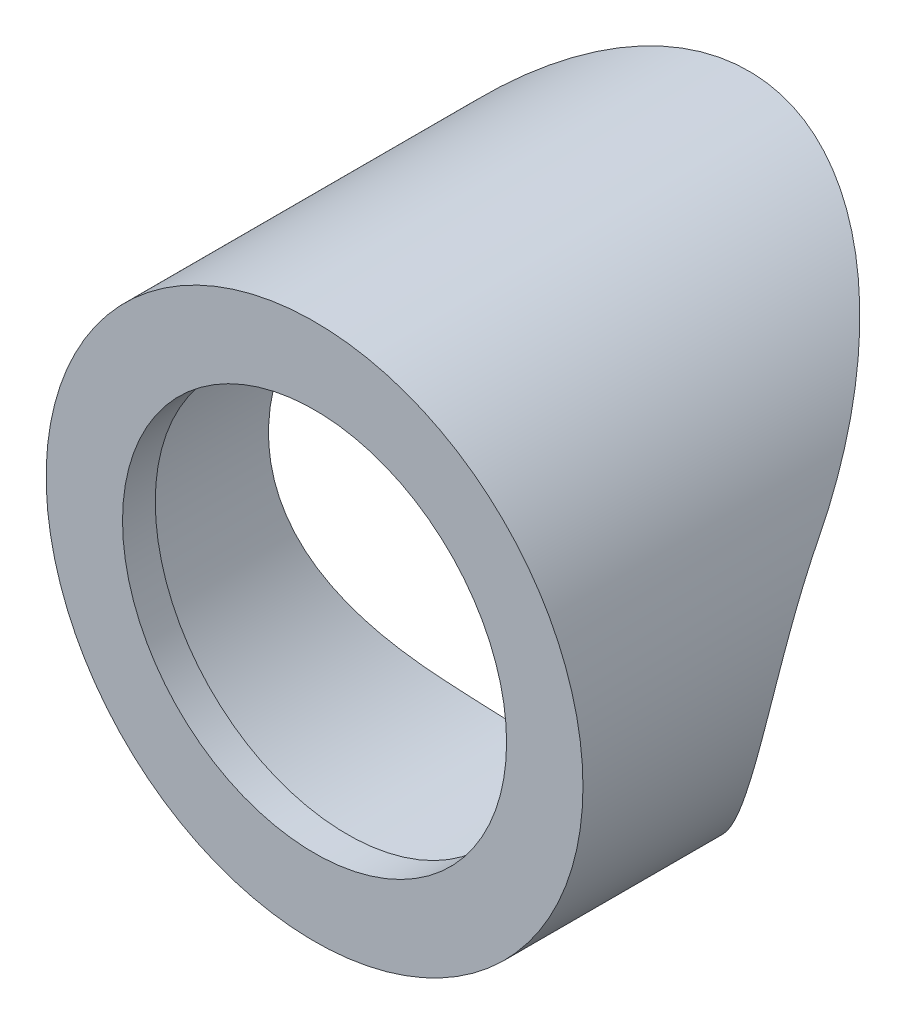
from build123d import *

# Parameters (mm, degrees)
ENL_V_MAT_EXTRU_1_DEPTH      = 27.506225684
ENL_V_MAT_EXTRU_1_DEPTH_BACK = 27.506225684
ESQUISSE4_W                  = 2
ESQUISSE4_H                  = 1.5
BOSS_EXTRU_1_DEPTH           = 5


with BuildPart() as part:
    # Esquisse2 → Révolution1 (revolve)
    with BuildSketch(Plane(origin=(0, 0, 0), x_dir=(0, 0, -1), z_dir=(1, 0, 0)), mode=Mode.PRIVATE) as r_volution1_sk:
        Polygon((0, 8.8), (1.5, 8.8), (1.5, 10.8), (20, 10.8), (20, 12.3), (0, 12.3), align=None)
    revolve(r_volution1_sk.sketch.rotate(Axis((0, 0, 0), (0, 0, -1)), 90), axis=Axis((0, 0, 0), (0, 0, -1)))

    # Esquisse3 → Enlèv. mat.-Extru.1 (cut, two sides: drawn at the far end of the back side and taken through both)
    with BuildSketch(Plane(origin=(0, 0, 0), x_dir=(0, 0, -1), z_dir=(1, 0, 0)).offset(-ENL_V_MAT_EXTRU_1_DEPTH_BACK)):
        with BuildLine():
            Line((12.9, -12.3), (20, -12.3))
            Line((20, -12.3), (20, 12.3))
            Line((20, 12.3), (19.9, 12.3))
            Line((19.9, 12.3), (11.360418464, 3.778598776))
            ThreePointArc((11.360418464, 3.778598776), (8.434822501, -2.833753193), (10.731771752, -9.689869764))
            Line((10.731771752, -9.689869764), (12.9, -12.3))
        make_face()
    extrude(amount=ENL_V_MAT_EXTRU_1_DEPTH + ENL_V_MAT_EXTRU_1_DEPTH_BACK, mode=Mode.SUBTRACT)

    # Esquisse4 → Boss.-Extru.1 (add)
    with BuildSketch(Plane(origin=(0, 0, -1.5), x_dir=(-1, 0, 0), z_dir=(0, 0, -1))):
        with Locations((0, 10.05)):
            Rectangle(ESQUISSE4_W, ESQUISSE4_H)
    extrude(amount=BOSS_EXTRU_1_DEPTH)


solid = part.part
